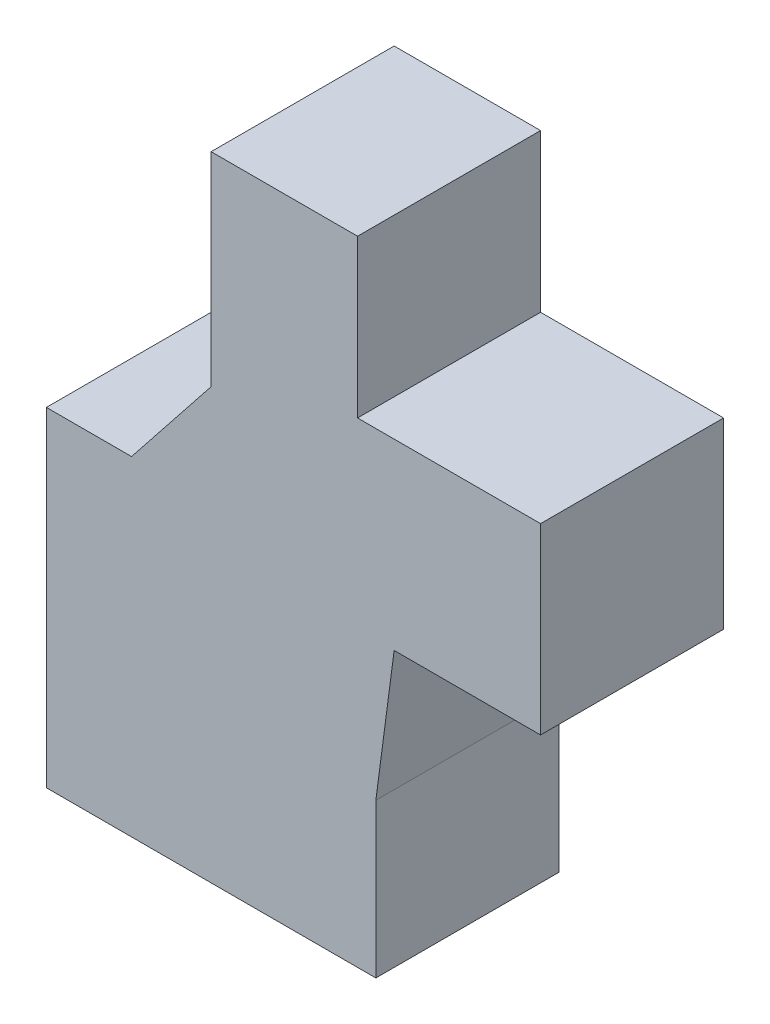
from build123d import *

# Parameters (mm, degrees)
BOSS_EXTRUDE3_DEPTH = 50


with BuildPart() as part:
    # Sketch1 → Boss-Extrude3 (new body)
    with BuildSketch(Plane.XY):
        Polygon((0, 72.397145713), (-21.738841924, 45), (-45, 45), (-45, -45), (45, -45), (45, -2.951552963), (50, 35), (90, 35), (90, 85), (40, 85), (40, 128), (0, 128), align=None)
    extrude(amount=BOSS_EXTRUDE3_DEPTH)


solid = part.part
